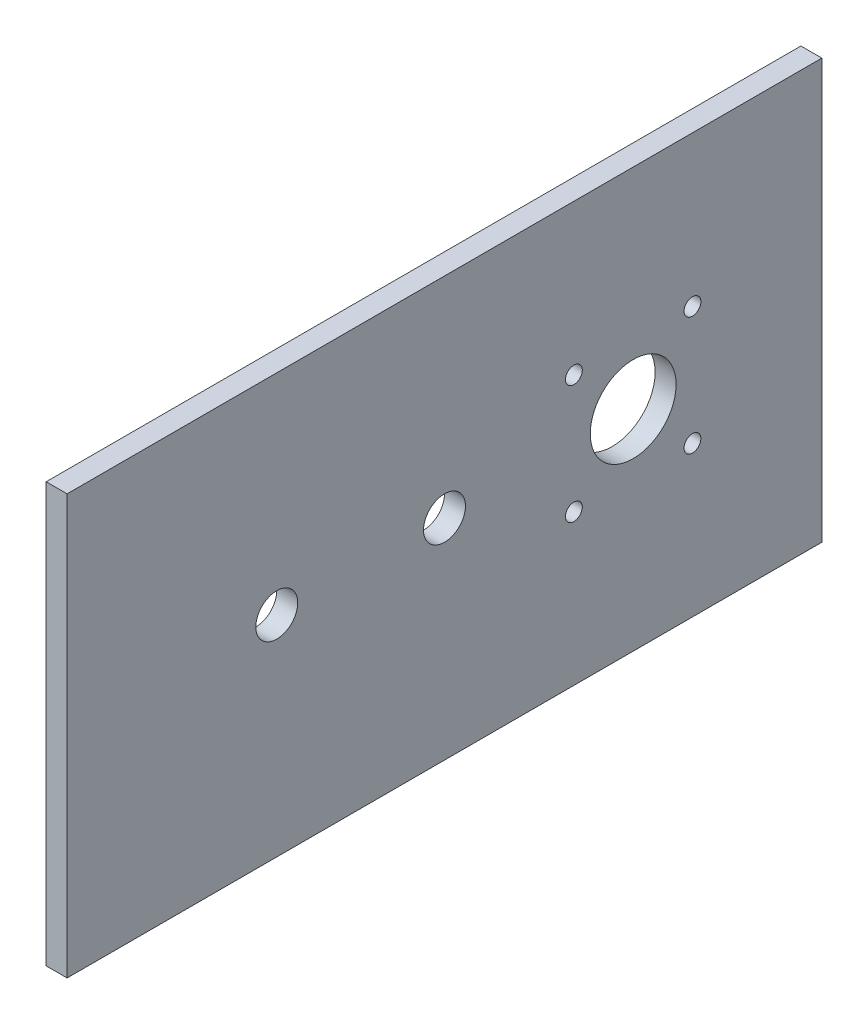
from build123d import *

# Parameters (mm, degrees)
SKETCH2_W           = 228.6
SKETCH2_H           = 127
SKETCH2_R           = 6.35
SKETCH2_R_2         = 13.000000035
SKETCH2_R_3         = 2.5527
BOSS_EXTRUDE2_DEPTH = 6.35


with BuildPart() as part:
    # Sketch2 → Boss-Extrude2 (new body)
    with BuildSketch(Plane(origin=(0, 0, 0), x_dir=(0, 0, -1), z_dir=(1, 0, 0))):
        Rectangle(SKETCH2_W, SKETCH2_H)
        with Locations((-50.8, 0)):
            Circle(SKETCH2_R, mode=Mode.SUBTRACT)
        with Locations((57.15, 0)):
            Circle(SKETCH2_R_2, mode=Mode.SUBTRACT)
        Circle(SKETCH2_R, mode=Mode.SUBTRACT)
        with Locations((75.110512242, 17.960512242)):
            Circle(SKETCH2_R_3, mode=Mode.SUBTRACT)
        with Locations((75.110512242, -17.960512242)):
            Circle(SKETCH2_R_3, mode=Mode.SUBTRACT)
        with Locations((39.189487758, -17.960512242)):
            Circle(SKETCH2_R_3, mode=Mode.SUBTRACT)
        with Locations((39.189487758, 17.960512242)):
            Circle(SKETCH2_R_3, mode=Mode.SUBTRACT)
    extrude(amount=BOSS_EXTRUDE2_DEPTH)


solid = part.part
